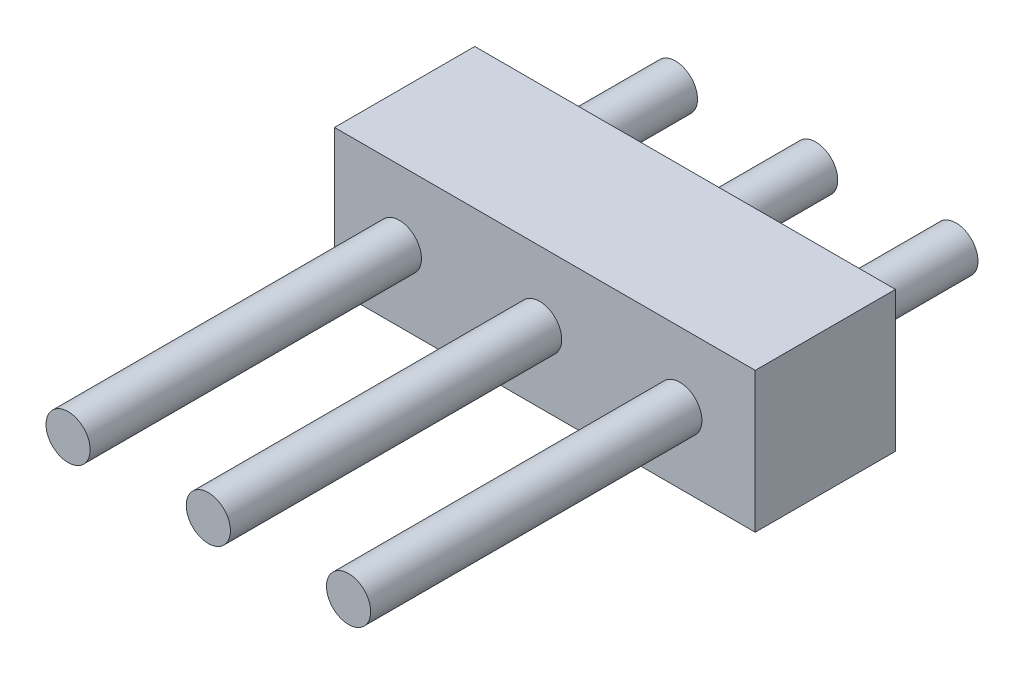
from build123d import *

# Parameters (mm, degrees)
SKETCH_1_W           = 7.62
SKETCH_1_H           = 2.54
EXTRUDE_1_DEPTH      = 2.54
EXTRUDE_2_DEPTH      = 6
EXTRUDE_2_DEPTH_BACK = 5
SKETCH_2_R           = 0.4


with BuildPart() as part:
    # Эскиз1 → Вытянуть1 (new body)
    with BuildSketch(Plane.XY):
        with Locations((3.81, 1.27)):
            Rectangle(SKETCH_1_W, SKETCH_1_H)
    extrude(amount=EXTRUDE_1_DEPTH)

    # Эскиз2 → Вытянуть2 (add, two sides: drawn at the far end of the back side and taken through both)
    with BuildSketch(Plane.XY.offset(2.54).offset(-EXTRUDE_2_DEPTH_BACK)):
        with Locations((1.174408602, 1.27)):
            Circle(SKETCH_2_R)
        with Locations((3.714408602, 1.27)):
            Circle(SKETCH_2_R)
        with Locations((6.254408602, 1.27)):
            Circle(SKETCH_2_R)
    extrude(amount=EXTRUDE_2_DEPTH + EXTRUDE_2_DEPTH_BACK)


solid = part.part
